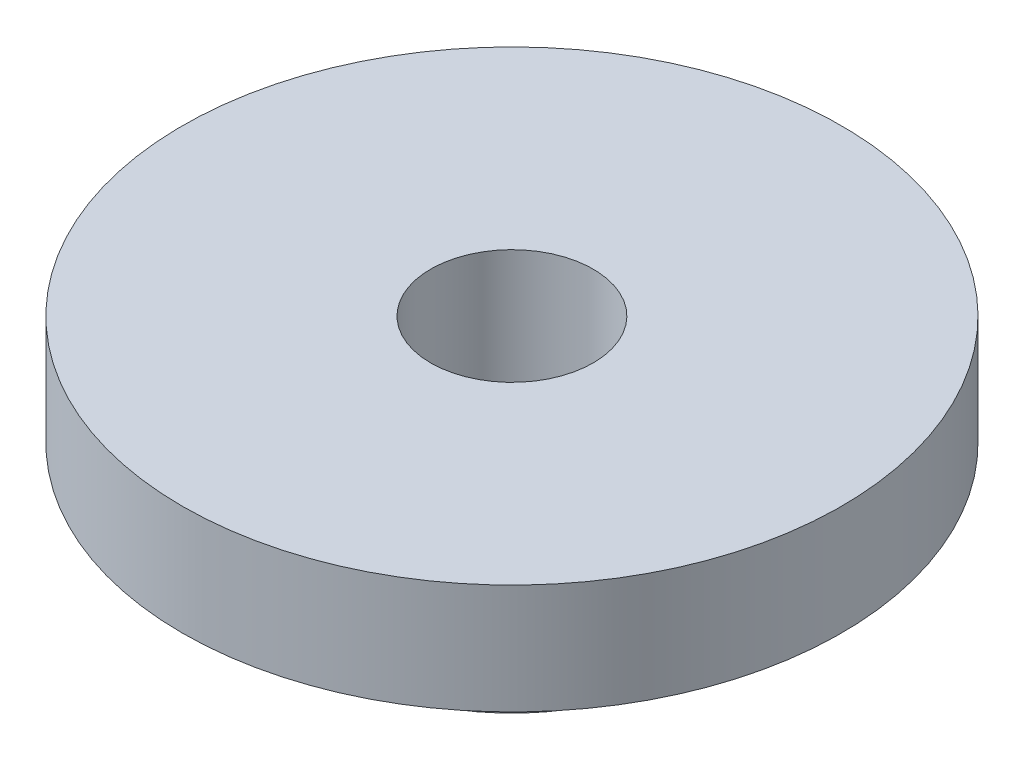
from build123d import *

# Parameters (mm, degrees)
SKETCH1_R           = 4
BOSS_EXTRUDE1_DEPTH = 2.5
SKETCH2_R           = 7.5
BOSS_EXTRUDE2_DEPTH = 2.5
SKETCH3_R           = 1.85
CUT_EXTRUDE1_DEPTH  = 18


with BuildPart() as part:
    # Sketch1 → Boss-Extrude1 (new body)
    with BuildSketch(Plane(origin=(0, 0, 0), x_dir=(1, 0, 0), z_dir=(0, 1, 0))):
        with Locations(Location((0, 0, 0), (0, 0, 270))):
            Circle(SKETCH1_R)
    extrude(amount=BOSS_EXTRUDE1_DEPTH)

    # Sketch2 → Boss-Extrude2 (add)
    with BuildSketch(Plane(origin=(0, 2.5, 0), x_dir=(1, 0, 0), z_dir=(0, 1, 0))):
        with Locations(Location((0, 0, 0), (0, 0, 270))):
            Circle(SKETCH2_R)
    extrude(amount=BOSS_EXTRUDE2_DEPTH)

    # Sketch3 → Cut-Extrude1 (cut)
    with BuildSketch(Plane(origin=(0, 5, 0), x_dir=(1, 0, 0), z_dir=(0, 1, 0))):
        with Locations(Location((0, 0, 0), (0, 0, 270))):
            Circle(SKETCH3_R)
    extrude(amount=-CUT_EXTRUDE1_DEPTH, mode=Mode.SUBTRACT)


solid = part.part
